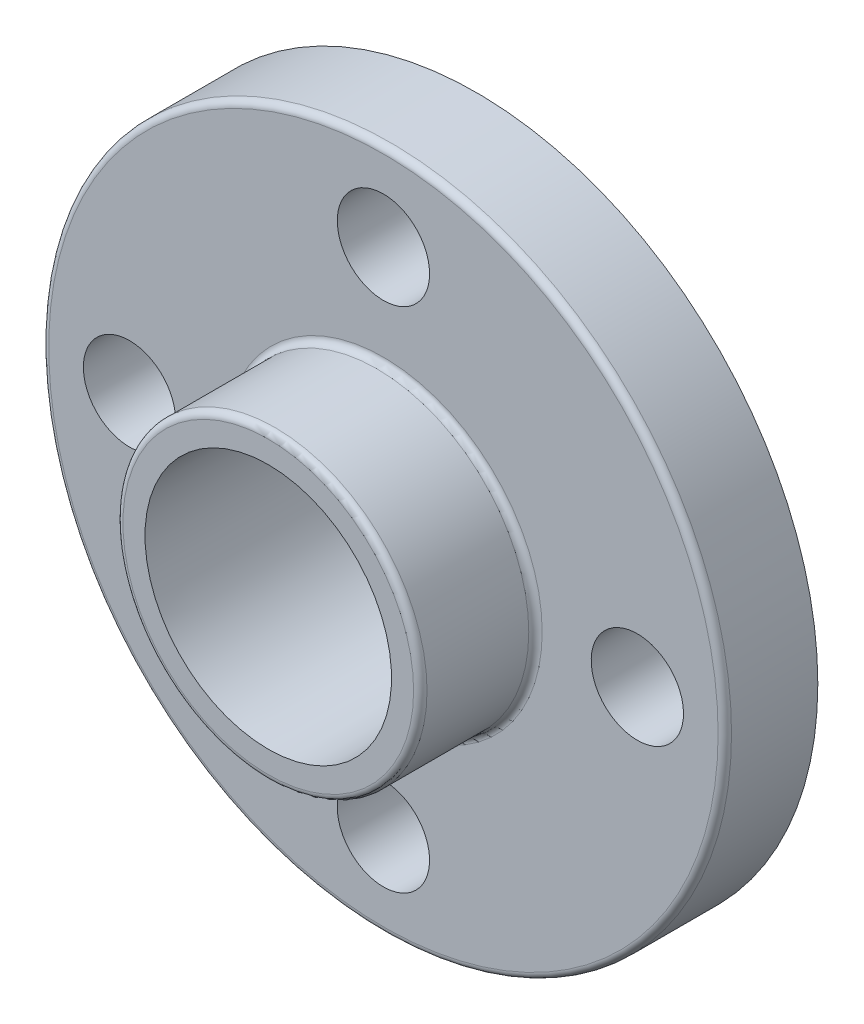
from build123d import *

# Parameters (mm, degrees)
SKETCH1_R         = 58.7375
EXTRUDE1_DEPTH    = 16.002
SKETCH2_R         = 26.162
EXTRUDE2_DEPTH    = 19.812
SKETCH3_R         = 7.9375
EXTRUDE3_DEPTH    = 86.39732523
CIRPATTERN1_COUNT = 4
FILLET1_R         = 1.154545455


with BuildPart() as part:
    # Sketch1 → Extrude1 (new body)
    with BuildSketch(Plane.XY):
        Circle(SKETCH1_R)
    extrude(amount=EXTRUDE1_DEPTH)

    # Sketch2 → Extrude2 (add)
    with BuildSketch(Plane.XY.offset(16.002)):
        Circle(SKETCH2_R)
    extrude(amount=EXTRUDE2_DEPTH)

    # Sketch3 → Extrude3 (cut, through all)
    with BuildSketch(Plane.XY.offset(16.002)):
        with Locations((0, 43.688)):
            Circle(SKETCH3_R)
    extrude3 = extrude(amount=-EXTRUDE3_DEPTH, mode=Mode.SUBTRACT)

    # CirPattern1: Extrude3 ×4 about axis
    cirpattern1_axis = Axis((0, 0, 0), (0, 0, 1))
    for i in range(1, CIRPATTERN1_COUNT):
        add(extrude3.rotate(cirpattern1_axis, i * 360 / CIRPATTERN1_COUNT), mode=Mode.SUBTRACT)

    # Fillet1
    fillet1_edges = [part.edges().sort_by_distance(p)[0] for p in [
        (-58.7375, 0, 16.002),
        (-26.162, 0, 16.002),
        (-26.162, 0, 35.814),
    ]]
    fillet(fillet1_edges, radius=FILLET1_R)

    # Sketch4 → Cut-Revolve1 (revolve, cut)
    with BuildSketch(Plane(origin=(0, 0, 63.5), x_dir=(0, 0, -1), z_dir=(1, 0, 0))):
        Polygon((27.686, 21.209), (59.182, 21.0185), (59.182, 16.2306), (63.5, 16.2306), (63.5, 0), (27.686, 0), align=None)
    revolve(axis=Axis((0, 0, 0), (0, 0, 1)), mode=Mode.SUBTRACT)


solid = part.part
